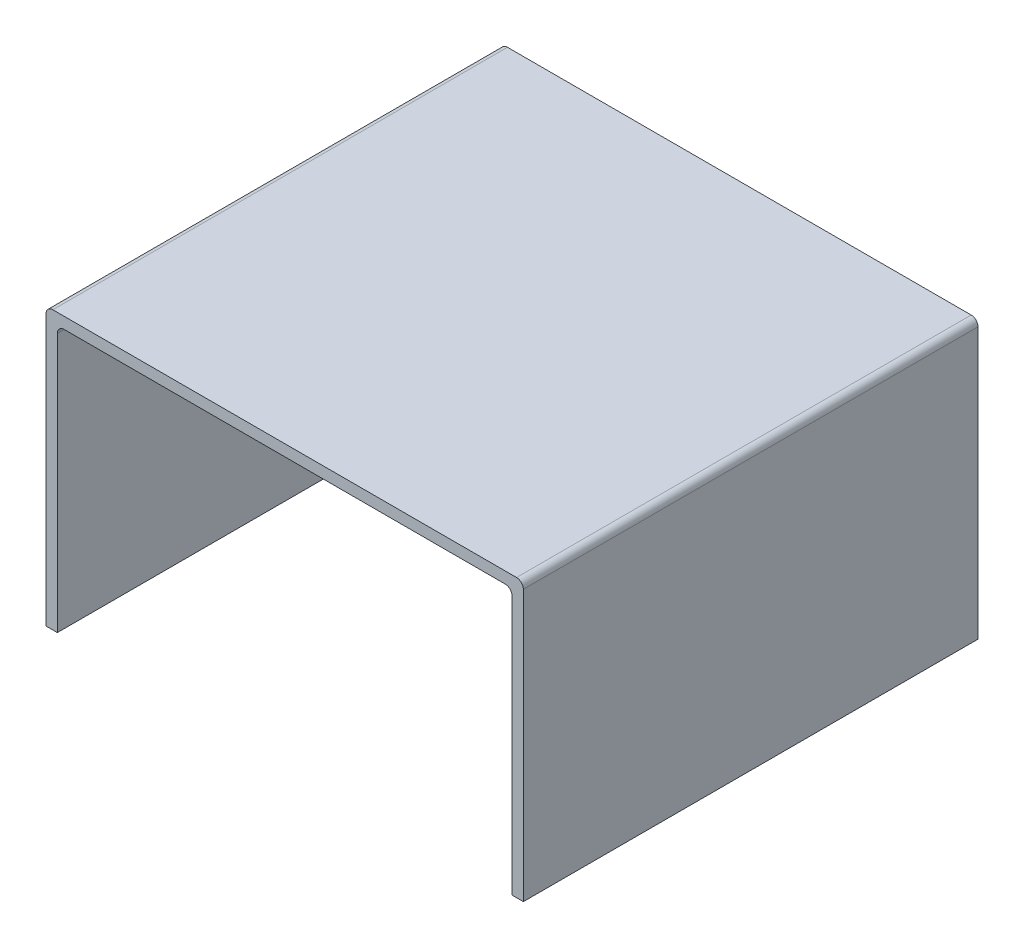
from build123d import *

# Parameters (mm, degrees)
BOSS_EXTRUDE1_DEPTH = 200


with BuildPart() as part:
    # Sketch1 → Boss-Extrude1 (new body)
    with BuildSketch(Plane.XY):
        with BuildLine():
            Line((0, 0), (0, 119))
            ThreePointArc((0, 119), (0.878679656, 121.121320344), (3, 122))
            Line((3, 122), (207, 122))
            ThreePointArc((207, 122), (209.121320344, 121.121320344), (210, 119))
            Line((210, 119), (210, 0))
            Line((210, 0), (205, 0))
            Line((205, 0), (205, 114))
            ThreePointArc((205, 114), (204.121320344, 116.121320344), (202, 117))
            Line((202, 117), (8, 117))
            ThreePointArc((8, 117), (5.878679656, 116.121320344), (5, 114))
            Line((5, 114), (5, 0))
            Line((5, 0), (0, 0))
        make_face()
    extrude(amount=BOSS_EXTRUDE1_DEPTH)


solid = part.part
